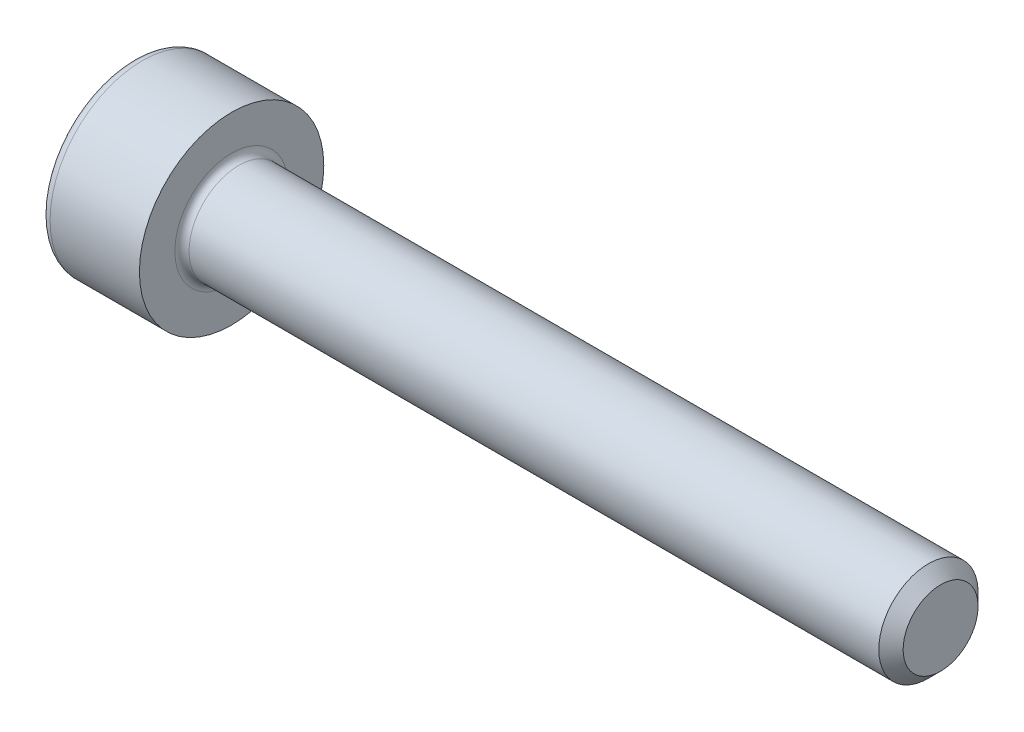
from build123d import *

# Parameters (mm, degrees)
FILLET1_R   = 0.1
FILLET2_R   = 0.14
HEX_2_DEPTH = 0.6


with BuildPart() as part:
    # BodySke → Base-Revolve (revolve)
    with BuildSketch(Plane.XY, mode=Mode.PRIVATE) as base_revolve_sk:
        Polygon((0, 0), (0, 1.3), (1.4, 1.3), (1.4, 0.7), (11.2285, 0.7), (11.4, 0.5285), (11.4, 0), align=None)
    revolve(base_revolve_sk.sketch.rotate(Axis((-31.75, 0, 0), (1, 0, 0)), 90), axis=Axis((-31.75, 0, 0), (1, 0, 0)))

    # Fillet1
    fillet1_edges = [part.edges().sort_by_distance(p)[0] for p in [
        (1.4, 0, -0.7),
    ]]
    fillet(fillet1_edges, radius=FILLET1_R)

    # Fillet2
    fillet2_edges = [part.edges().sort_by_distance(p)[0] for p in [
        (0, 0, -1.3),
    ]]
    fillet(fillet2_edges, radius=FILLET2_R)

    # Sketch2 → Hex-PreBroach (revolve, cut)
    with BuildSketch(Plane.XY, mode=Mode.PRIVATE) as hex_prebroach_sk:
        Polygon((0, 0.66), (0.6, 0.66), (0.981051178, 0), (0, 0), align=None)
    revolve(hex_prebroach_sk.sketch.rotate(Axis((0, 0, 0), (1, 0, 0)), 90), axis=Axis((0, 0, 0), (1, 0, 0)), mode=Mode.SUBTRACT)

    # Sketch3 → Hex 2 (cut)
    with BuildSketch(Plane(origin=(0, 0, 0), x_dir=(0, 0.500000000000001, 0.866025403784438), z_dir=(-1, 0, 0))):
        Polygon((0.381051178, 0.66), (-0.381051178, 0.66), (-0.762102355, 0), (-0.381051178, -0.66), (0.381051178, -0.66), (0.762102355, 0), align=None)
    extrude(amount=-HEX_2_DEPTH, mode=Mode.SUBTRACT)


solid = part.part
